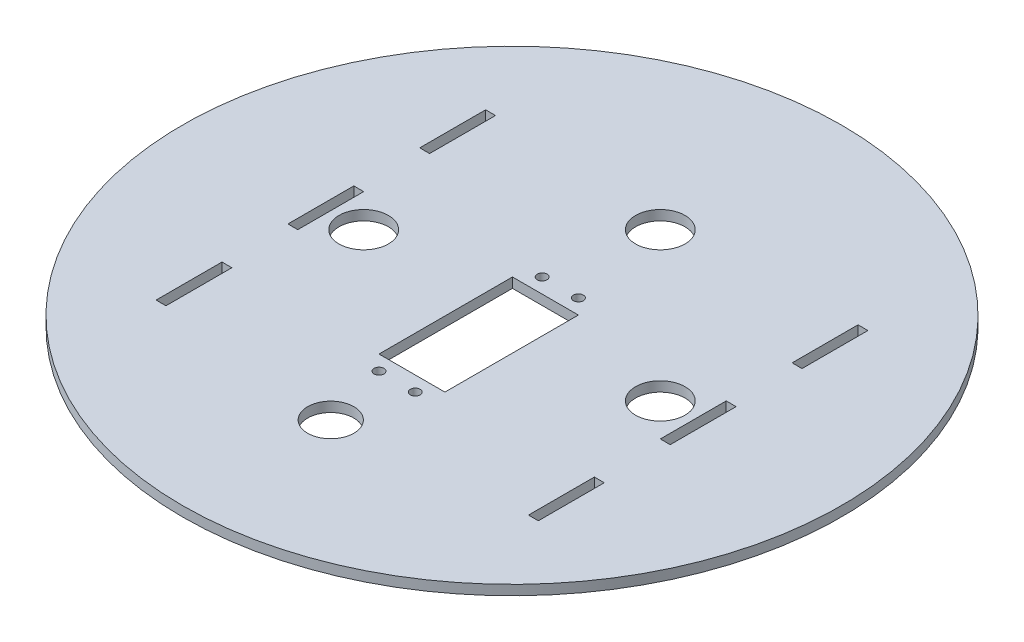
from build123d import *

# Parameters (mm, degrees)
SKETCH2_R           = 100
BOSS_EXTRUDE1_DEPTH = 1.5
CUT_EXTRUDE2_DEPTH  = 10
SKETCH6_R           = 7.5
SKETCH6_R_2         = 7
CUT_EXTRUDE3_DEPTH  = 10
SKETCH3_W           = 3
SKETCH3_H           = 20
CUT_EXTRUDE4_DEPTH  = 10
SKETCH7_R           = 1.5
CUT_EXTRUDE5_DEPTH  = 10


with BuildPart() as part:
    # Sketch2 → Boss-Extrude1 (new, symmetric)
    with BuildSketch(Plane(origin=(0, 0, 0), x_dir=(1, 0, 0), z_dir=(0, 1, 0))):
        with Locations(Location((0, 0, 0), (0, 0, 270))):
            Circle(SKETCH2_R)
    extrude(amount=BOSS_EXTRUDE1_DEPTH, both=True)

    # Sketch5 → Cut-Extrude2 (cut)
    with BuildSketch(Plane.XZ.offset(1.5)):
        Polygon((0, 30.36), (10, 30.36), (10, -10.14), (-10, -10.14), (-10, 30.36), align=None)
    extrude(amount=-CUT_EXTRUDE2_DEPTH, mode=Mode.SUBTRACT)

    # Sketch6 → Cut-Extrude3 (cut)
    with BuildSketch(Plane.XZ.offset(1.5)):
        with Locations(Location((-45, 0, 0), (0, 0, 270))):
            Circle(SKETCH6_R)
        with Locations(Location((0, -45, 0), (0, 0, 270))):
            Circle(SKETCH6_R)
        with Locations(Location((45, 0, 0), (0, 0, 270))):
            Circle(SKETCH6_R)
        with Locations(Location((0, 55, 0), (0, 0, 270))):
            Circle(SKETCH6_R_2)
    extrude(amount=-CUT_EXTRUDE3_DEPTH, mode=Mode.SUBTRACT)

    # Sketch3 → Cut-Extrude4 (cut)
    with BuildSketch(Plane.XZ.offset(1.5)):
        with Locations((-56.5, 40)):
            Rectangle(SKETCH3_W, SKETCH3_H)
        Polygon((-55, -10), (-55, 0), (-55, 10), (-58, 10), (-58, 0), (-58, -10), align=None)
        with Locations((-56.5, -40)):
            Rectangle(SKETCH3_W, SKETCH3_H)
        with Locations((56.5, 40)):
            Rectangle(SKETCH3_W, SKETCH3_H)
        with Locations((56.5, 0)):
            Rectangle(SKETCH3_W, SKETCH3_H)
        with Locations((56.5, -40)):
            Rectangle(SKETCH3_W, SKETCH3_H)
    extrude(amount=-CUT_EXTRUDE4_DEPTH, mode=Mode.SUBTRACT)

    # Sketch7 → Cut-Extrude5 (cut)
    with BuildSketch(Plane(origin=(0, -1.5, 0), x_dir=(-1, 0, 0), z_dir=(0, -1, 0))):
        with Locations(Location((5.5, -34.86, 0), (0, 0, 90))):
            Circle(SKETCH7_R)
        with Locations(Location((-5.5, -34.86, 0), (0, 0, 270))):
            Circle(SKETCH7_R)
        with Locations(Location((-5.5, 14.64, 0), (0, 0, 90))):
            Circle(SKETCH7_R)
        with Locations(Location((5.5, 14.64, 0), (0, 0, 270))):
            Circle(SKETCH7_R)
    extrude(amount=-CUT_EXTRUDE5_DEPTH, mode=Mode.SUBTRACT)


solid = part.part
